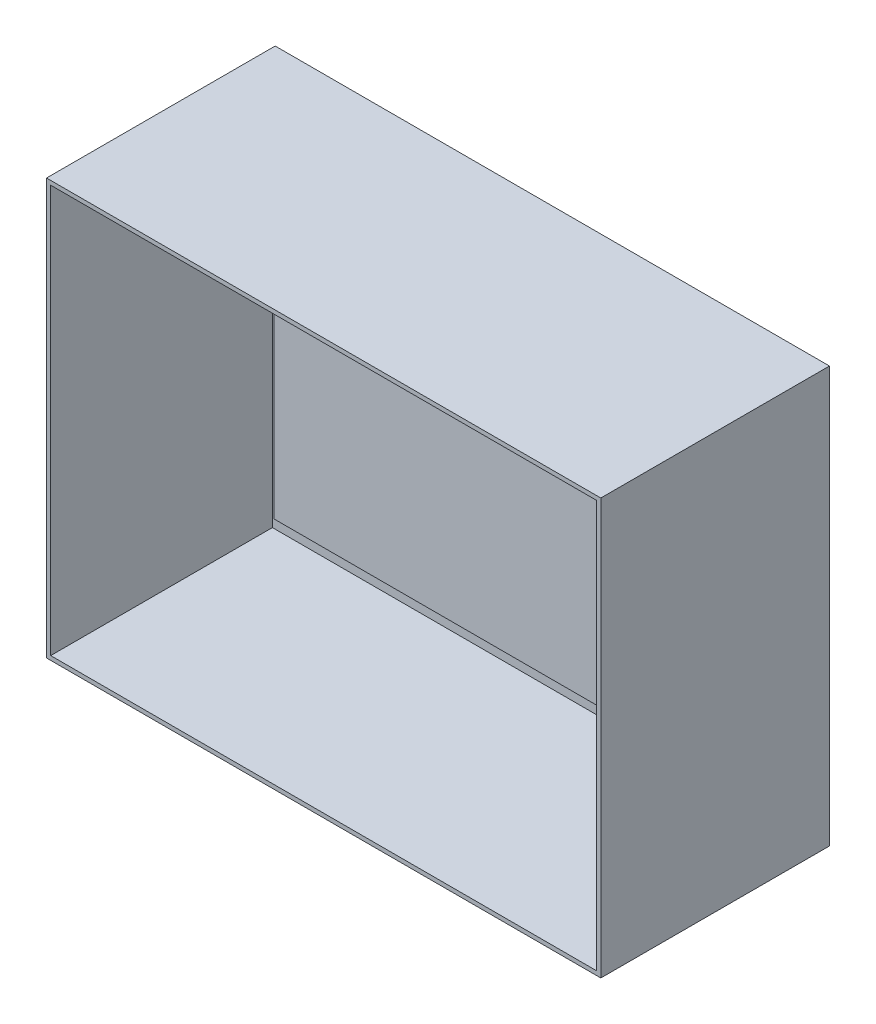
from build123d import *

# Parameters (mm, degrees)
SKETCH1_W           = 400
SKETCH1_H           = 300
BOSS_EXTRUDE1_DEPTH = 5
SKETCH2_W           = 400
SKETCH2_H           = 300
SKETCH2_W_2         = 394
SKETCH2_H_2         = 294
BOSS_EXTRUDE2_DEPTH = 165
SKETCH3_W           = 350
SKETCH3_H           = 240
BOSS_EXTRUDE3_DEPTH = 26


with BuildPart() as part:
    # Sketch1 → Boss-Extrude1 (new body)
    with BuildSketch(Plane.XY):
        Rectangle(SKETCH1_W, SKETCH1_H)
    extrude(amount=BOSS_EXTRUDE1_DEPTH)

    # Sketch2 → Boss-Extrude2 (add)
    with BuildSketch(Plane.XY):
        Rectangle(SKETCH2_W, SKETCH2_H)
        Rectangle(SKETCH2_W_2, SKETCH2_H_2, mode=Mode.SUBTRACT)
    extrude(amount=BOSS_EXTRUDE2_DEPTH)

    # Sketch3 → Boss-Extrude3 (add)
    with BuildSketch(Plane.XY):
        Rectangle(SKETCH3_W, SKETCH3_H)
    extrude(amount=BOSS_EXTRUDE3_DEPTH)


solid = part.part
